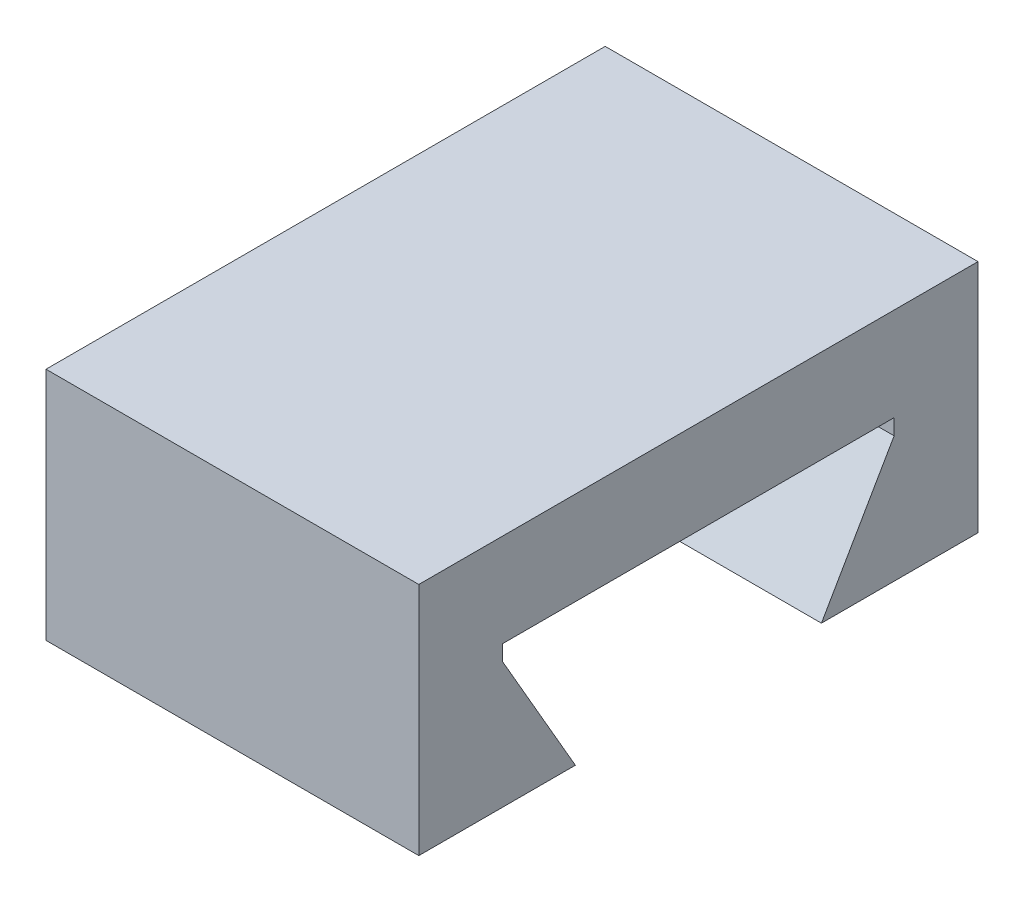
from build123d import *

# Parameters (mm, degrees)
BOSS_EXTRUDE1_DEPTH = 25.4


with BuildPart() as part:
    # Sketch1 → Boss-Extrude1 (new body)
    with BuildSketch(Plane(origin=(0, 0, 0), x_dir=(0, 0, -1), z_dir=(1, 0, 0))):
        Polygon((0, 0), (0, -16.002), (10.668, -16.002), (5.715, -7.42315235), (5.715, -6.35), (32.385, -6.35), (32.385, -7.42315235), (27.432, -16.002), (38.1, -16.002), (38.1, 0), align=None)
    extrude(amount=BOSS_EXTRUDE1_DEPTH)


solid = part.part
